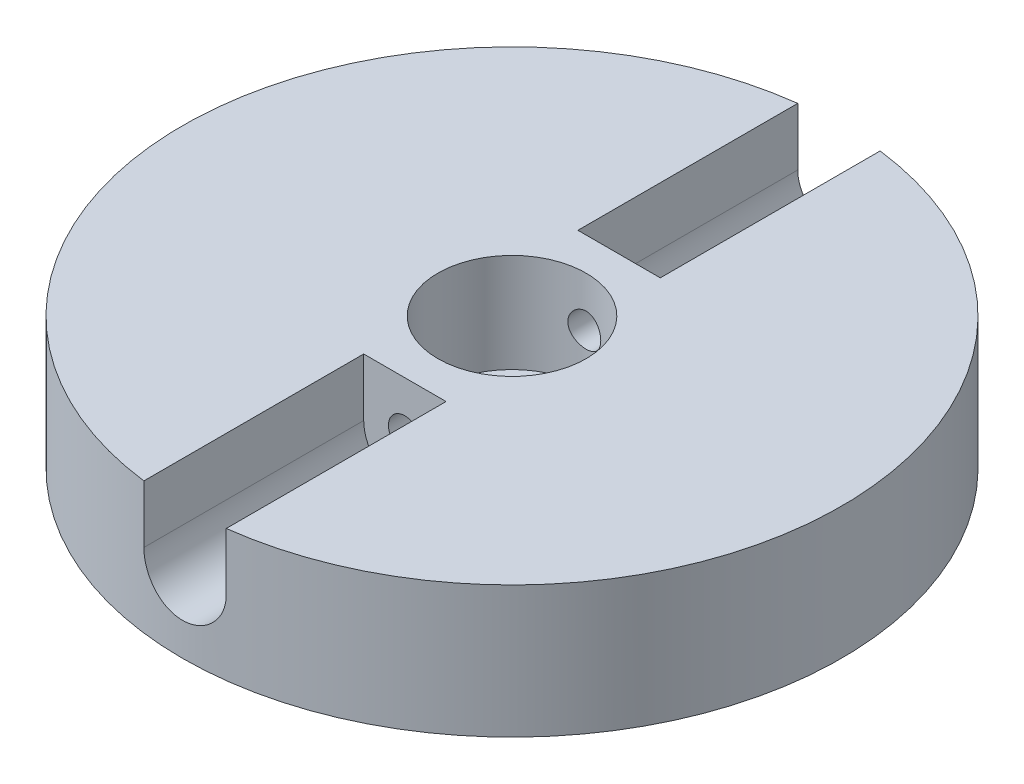
from build123d import *

# Parameters (mm, degrees)
SKETCH2_R               = 20
BOSS_EXTRUDE1_DEPTH     = 8
CUT_EXTRUDE7_DEPTH      = 33.622844756
CUT_EXTRUDE7_DEPTH_BACK = 33.622844756
SKETCH7_R               = 1
CUT_EXTRUDE8_DEPTH      = 13.5
CUT_EXTRUDE15_DEPTH     = 15
SKETCH3_R               = 4.5
CUT_EXTRUDE16_DEPTH     = 6
SKETCH12_R              = 1.5
CUT_EXTRUDE17_DEPTH     = 3


with BuildPart() as part:
    # Sketch2 → Boss-Extrude1 (new body)
    with BuildSketch(Plane(origin=(0, 0, 0), x_dir=(1, 0, 0), z_dir=(0, 1, 0))):
        with Locations(Location((0, 0, 0), (0, 0, 270))):
            Circle(SKETCH2_R)
    extrude(amount=BOSS_EXTRUDE1_DEPTH)

    # Sketch7 → Cut-Extrude7 (cut, two sides: drawn at the far end of the back side and taken through both)
    with BuildSketch(Plane.XY.offset(4.5).offset(-CUT_EXTRUDE7_DEPTH_BACK)):
        with Locations(Location((0, 5, 0), (0, 0, 90))):
            Circle(SKETCH7_R)
    extrude(amount=CUT_EXTRUDE7_DEPTH + CUT_EXTRUDE7_DEPTH_BACK, mode=Mode.SUBTRACT)

    # Sketch9 → Cut-Extrude8 (cut)
    with BuildSketch(Plane.XY.offset(20)):
        with BuildLine():
            Line((2.5, 4.5), (2.5, 8))
            Line((2.5, 8), (-2.5, 8))
            Line((-2.5, 8), (-2.5, 4.5))
            ThreePointArc((-2.5, 4.5), (0, 2), (2.5, 4.5))
        make_face()
    extrude(amount=-CUT_EXTRUDE8_DEPTH, mode=Mode.SUBTRACT)

    # Sketch10 → Cut-Extrude15 (cut)
    with BuildSketch(Plane.XY.offset(-6.5)):
        with BuildLine():
            Line((0, 8), (0, 2))
            ThreePointArc((0, 2), (1.767766953, 2.732233047), (2.5, 4.5))
            Line((2.5, 4.5), (2.5, 8))
            Line((2.5, 8), (0, 8))
        make_face()
        with BuildLine():
            ThreePointArc((-2.5, 4.5), (-1.767766953, 2.732233047), (0, 2))
            Line((0, 2), (0, 8))
            Line((0, 8), (-2.5, 8))
            Line((-2.5, 8), (-2.5, 4.5))
        make_face()
    extrude(amount=-CUT_EXTRUDE15_DEPTH, mode=Mode.SUBTRACT)

    # Sketch3 → Cut-Extrude16 (cut)
    with BuildSketch(Plane(origin=(0, 8, 0), x_dir=(1, 0, 0), z_dir=(0, 1, 0))):
        with Locations(Location((0, 0, 0), (0, 0, 270))):
            Circle(SKETCH3_R)
    extrude(amount=-CUT_EXTRUDE16_DEPTH, mode=Mode.SUBTRACT)

    # Sketch12 → Cut-Extrude17 (cut)
    with BuildSketch(Plane.XZ):
        with Locations(Location((-8.485281374, 8.485281374, 0), (0, 0, 270))):
            Circle(SKETCH12_R)
        with Locations(Location((8.485281374, 8.485281374, 0), (0, 0, 270))):
            Circle(SKETCH12_R)
        with Locations(Location((8.485281374, -8.485281374, 0), (0, 0, 270))):
            Circle(SKETCH12_R)
        with Locations(Location((-8.485281374, -8.485281374, 0), (0, 0, 270))):
            Circle(SKETCH12_R)
    extrude(amount=-CUT_EXTRUDE17_DEPTH, mode=Mode.SUBTRACT)


solid = part.part
